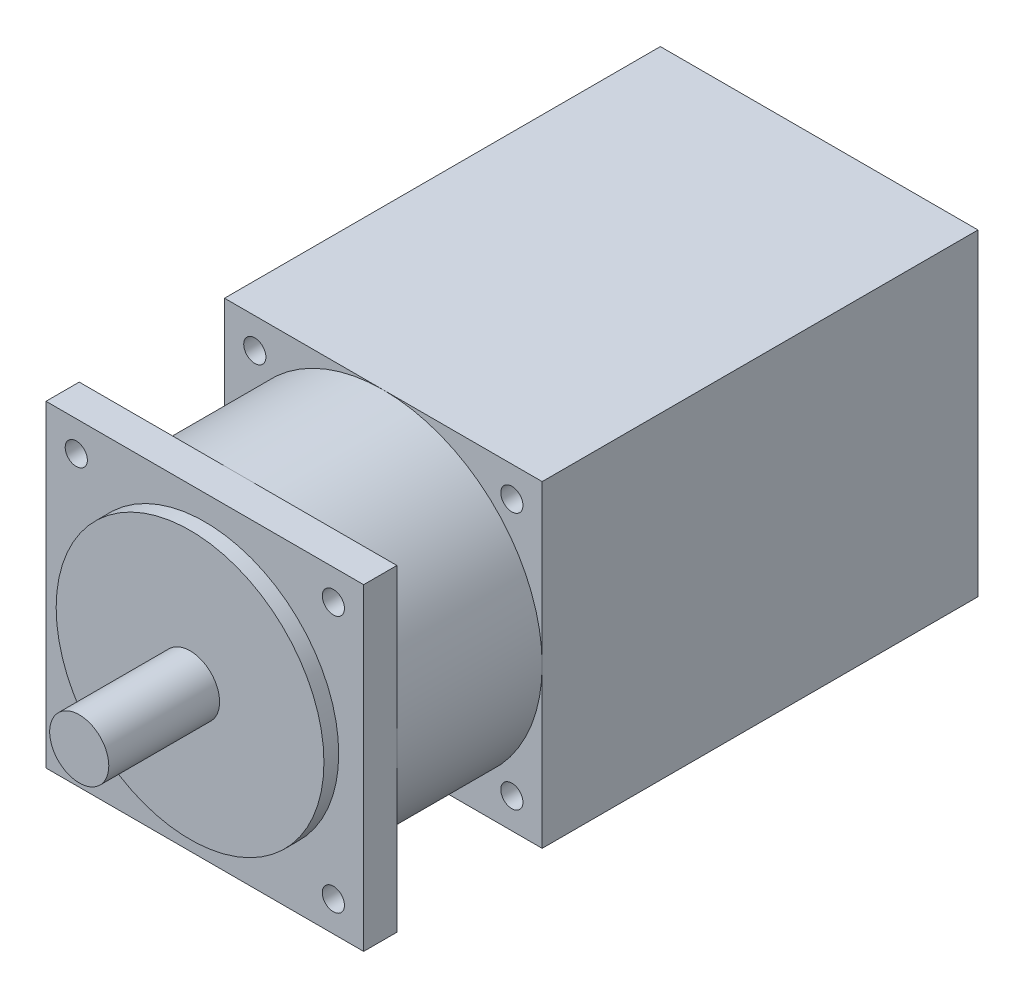
from build123d import *

# Parameters (mm, degrees)
SKETCH_1_W      = 86
SKETCH_1_H      = 86
SKETCH_1_R      = 3
EXTRUDE_1_DEPTH = 118
SKETCH_2_R      = 43
EXTRUDE_2_DEPTH = 39.333333333
SKETCH_3_W      = 86
SKETCH_3_H      = 86
SKETCH_3_R      = 3
EXTRUDE_3_DEPTH = 9
SKETCH_4_R      = 36.25
EXTRUDE_4_DEPTH = 4
SKETCH_5_R      = 8
EXTRUDE_5_DEPTH = 30


with BuildPart() as part:
    # 草图1 → 凸台-拉伸1 (new body)
    with BuildSketch(Plane.XY):
        Rectangle(SKETCH_1_W, SKETCH_1_H)
        with Locations((-34.8, 34.8)):
            Circle(SKETCH_1_R, mode=Mode.SUBTRACT)
        with Locations((34.8, 34.8)):
            Circle(SKETCH_1_R, mode=Mode.SUBTRACT)
        with Locations((34.8, -34.8)):
            Circle(SKETCH_1_R, mode=Mode.SUBTRACT)
        with Locations((-34.8, -34.8)):
            Circle(SKETCH_1_R, mode=Mode.SUBTRACT)
    extrude(amount=EXTRUDE_1_DEPTH)

    # 草图2 → 凸台-拉伸2 (add)
    with BuildSketch(Plane.XY.offset(118)):
        Circle(SKETCH_2_R)
    extrude(amount=EXTRUDE_2_DEPTH)

    # 草图3 → 凸台-拉伸3 (add)
    with BuildSketch(Plane.XY.offset(157.333333333)):
        Rectangle(SKETCH_3_W, SKETCH_3_H)
        with Locations((-34.8, 34.8)):
            Circle(SKETCH_3_R, mode=Mode.SUBTRACT)
        with Locations((34.8, 34.8)):
            Circle(SKETCH_3_R, mode=Mode.SUBTRACT)
        with Locations((34.8, -34.8)):
            Circle(SKETCH_3_R, mode=Mode.SUBTRACT)
        with Locations((-34.8, -34.8)):
            Circle(SKETCH_3_R, mode=Mode.SUBTRACT)
    extrude(amount=EXTRUDE_3_DEPTH)

    # 草图4 → 凸台-拉伸4 (add)
    with BuildSketch(Plane.XY.offset(166.333333333)):
        Circle(SKETCH_4_R)
    extrude(amount=EXTRUDE_4_DEPTH)

    # 草图5 → 凸台-拉伸5 (add)
    with BuildSketch(Plane.XY.offset(170.333333333)):
        Circle(SKETCH_5_R)
    extrude(amount=EXTRUDE_5_DEPTH)


solid = part.part
